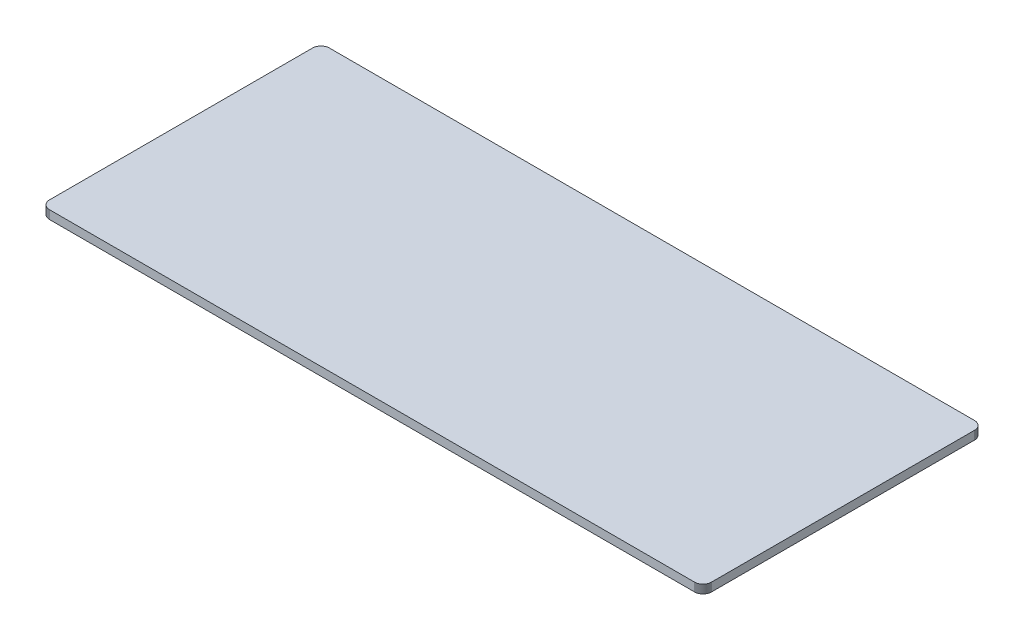
from build123d import *

# Parameters (mm, degrees)
BOSS_EXTRUDE2_DEPTH = 5


with BuildPart() as part:
    # Sketch3 → Boss-Extrude2 (new body)
    with BuildSketch(Plane(origin=(0, 0, 0), x_dir=(1, 0, 0), z_dir=(0, 1, 0))):
        Polygon((382.958, 164.299), (383.35, 164.284), (383.741, 164.237), (384.126, 164.162), (384.503, 164.055), (384.87, 163.919), (385.226, 163.755), (385.572, 163.564), (385.897, 163.344), (386.203, 163.102), (386.493, 162.834), (386.761, 162.547), (387.004, 162.238), (387.223, 161.913), (387.414, 161.569), (387.576, 161.212), (387.713, 160.845), (387.819, 160.467), (387.897, 160.082), (387.943, 159.693), (387.96, 159.299), (387.96, 5.27237), (387.943, 4.881), (387.897, 4.49104), (387.819, 4.10655), (387.713, 3.72759), (387.576, 3.35966), (387.414, 3.00412), (387.223, 2.66099), (387.004, 2.3344), (386.761, 2.02572), (386.493, 1.73771), (386.203, 1.47037), (385.897, 1.22783), (385.572, 1.0101), (385.226, 0.818554), (384.87, 0.654569), (384.503, 0.518142), (384.126, 0.412034), (383.741, 0.334863), (383.35, 0.289388), (382.958, 0.272852), (5.09598, 0.272852), (4.70186, 0.289388), (4.3119, 0.334863), (3.9274, 0.412034), (3.54983, 0.518142), (3.18189, 0.654569), (2.82498, 0.818554), (2.48185, 1.0101), (2.15663, 1.22783), (1.84795, 1.47037), (1.55994, 1.73771), (1.2926, 2.02572), (1.05006, 2.3344), (0.830957, 2.66099), (0.63941, 3.00412), (0.475424, 3.35966), (0.338998, 3.72759), (0.232888, 4.10655), (0.157097, 4.49104), (0.110243, 4.881), (0.0950846, 5.27375), (0.0950846, 159.299), (0.110243, 159.693), (0.157097, 160.082), (0.232888, 160.467), (0.338998, 160.845), (0.475424, 161.212), (0.63941, 161.569), (0.830957, 161.913), (1.05006, 162.238), (1.2926, 162.547), (1.55994, 162.834), (1.84795, 163.102), (2.15663, 163.344), (2.48185, 163.564), (2.82498, 163.755), (3.18189, 163.919), (3.54983, 164.055), (3.9274, 164.162), (4.3119, 164.237), (4.70186, 164.284), (5.09598, 164.299), align=None)
    extrude(amount=BOSS_EXTRUDE2_DEPTH)


solid = part.part
